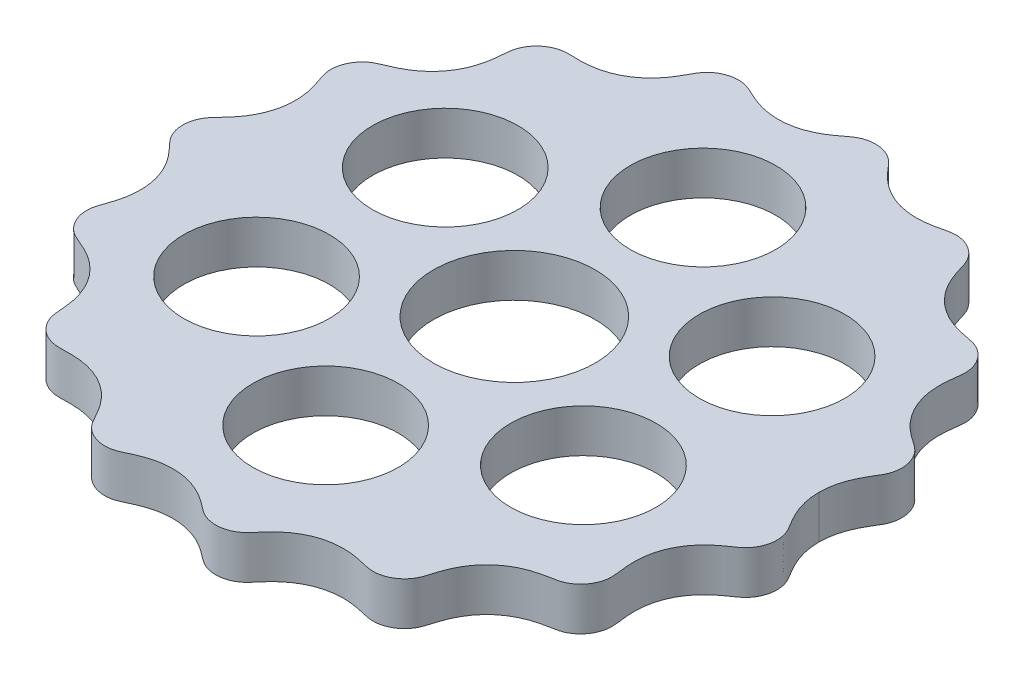
from build123d import *

# Parameters (mm, degrees)
SKETCH3_R           = 7.5
SKETCH3_R_2         = 6.75
BOSS_EXTRUDE1_DEPTH = 4


with BuildPart() as part:
    # Sketch3 → Boss-Extrude1 (new body)
    with BuildSketch(Plane(origin=(0, 0, 0), x_dir=(1, 0, 0), z_dir=(0, 1, 0))):
        with BuildLine():
            add(Edge.make_bspline(
                [(29.5, 0), (29.5, -0.029889461), (29.500501274, -0.089793684), (29.502757018, -0.199994007), (29.508769472, -0.345716178), (29.520033852, -0.516003517), (29.539534103, -0.719877503), (29.572667516, -0.972896461), (29.625712231, -1.26893095), (29.695940045, -1.57589139), (29.785086374, -1.891206047), (29.915742198, -2.279302585), (30.102039584, -2.734864508), (30.33495462, -3.200835277), (30.612620381, -3.677587615), (30.934069136, -4.194030434), (31.237194706, -4.727278247), (31.406093828, -5.378461077), (31.405725242, -6.117189546), (31.248335855, -6.800339452), (30.946423484, -7.409498164), (30.518681828, -7.912396516), (30.024477359, -8.2774), (29.550245165, -8.59502081), (29.055422495, -8.956812811), (28.55664588, -9.3787878), (28.071291676, -9.87632012), (27.618832314, -10.456259632), (27.233514149, -11.088357289), (26.923199049, -11.765079402), (26.693739537, -12.478190143), (26.549212855, -13.217291653), (26.492855654, -13.928538721), (26.50654453, -14.600813106), (26.567292453, -15.230937345), (26.651155977, -15.816199005), (26.716674088, -16.447312982), (26.62640489, -17.120976223), (26.35876322, -17.782346644), (25.918177073, -18.386904665), (25.381295585, -18.836179949), (24.795065003, -19.123538297), (24.20416515, -19.259668921), (23.651405896, -19.354435046), (23.149147383, -19.460869188), (22.701549759, -19.580730556), (22.221250647, -19.739640946), (21.713789444, -19.946736544), (21.145635648, -20.241997885), (20.533661927, -20.654546757), (19.969318303, -21.140042744), (19.462201082, -21.693788885), (19.020819266, -22.308674205), (18.671631778, -22.936971669), (18.402935315, -23.560968071), (18.196614764, -24.168544426), (18.031210068, -24.746637991), (17.836824154, -25.359563266), (17.481845811, -25.947378552), (16.962995745, -26.453160111), (16.302610967, -26.834433706), (15.605165751, -27.030879963), (14.918614525, -27.044392858), (14.290611017, -26.906273022), (13.707268128, -26.76047143), (13.077925596, -26.635361227), (12.403190484, -26.556062439), (11.684458703, -26.544316545), (10.931287881, -26.619125576), (10.198128539, -26.78142275), (9.495575967, -27.027420956), (8.914400316, -27.31099678), (8.446794063, -27.597140689), (8.075855138, -27.863479964), (7.791280828, -28.092219953), (7.481579097, -28.367944206), (7.154069437, -28.695657759), (6.810708629, -29.077401095), (6.45228992, -29.50872604), (6.038931991, -29.952392783), (5.496965868, -30.316405455), (4.839435928, -30.556720046), (4.095583639, -30.636000314), (3.38899707, -30.537099289), (2.760454369, -30.27844327), (2.246651709, -29.906145821), (1.781732794, -29.540887108), (1.266402425, -29.173215737), (0.691041037, -28.825223584), (0.046903188, -28.518406928), (-0.66543903, -28.274019755), (-1.397743593, -28.116182477), (-2.138955211, -28.046561644), (-2.879034252, -28.064209022), (-3.607493969, -28.166079072), (-4.281067062, -28.337644457), (-4.895863657, -28.558606199), (-5.456648804, -28.806245606), (-5.968747032, -29.058121981), (-6.532079721, -29.303629152), (-7.181276314, -29.422592585), (-7.882649472, -29.378078239), (-8.594278351, -29.15231418), (-9.198278317, -28.780347353), (-9.667919205, -28.297811687), (-9.987828208, -27.756370733), (-10.260491808, -27.237871371), (-10.576767616, -26.696230387), (-10.953650895, -26.146870654), (-11.408815704, -25.605953656), (-11.950184555, -25.092464451), (-12.548165998, -24.645439778), (-13.194493936, -24.272282169), (-13.88061938, -23.977927385), (-14.595998502, -23.765832809), (-15.292028768, -23.642107021), (-15.956229893, -23.590396394), (-16.583442648, -23.587314002), (-17.168808068, -23.610430078), (-17.79766419, -23.604101232), (-18.450372779, -23.438648125), (-19.074505483, -23.101552224), (-19.625837334, -22.598145566), (-20.015074466, -22.012995768), (-20.23664741, -21.391293307), (-20.305698303, -20.780679307), (-20.343616085, -20.211251037), (-20.409546628, -19.601777164), (-20.525586467, -18.958866797), (-20.713792994, -18.28975274), (-20.98980086, -17.607953023), (-21.344557209, -16.958202197), (-21.775456582, -16.351104338), (-22.2782997, -15.795828927), (-22.846116736, -15.301115548), (-23.433895979, -14.896684969), (-24.022947843, -14.572402127), (-24.599023965, -14.309950779), (-25.147809675, -14.089945054), (-25.727125692, -13.831132821), (-26.26540634, -13.416119), (-26.704339817, -12.853660239), (-27.007624154, -12.169804958), (-27.128243584, -11.480242215), (-27.084026477, -10.828826935), (-26.906402138, -10.249106449), (-26.7122212, -9.722867749), (-26.524712227, -9.148060531), (-26.36609006, -8.521461383), (-26.260469314, -7.840015999), (-26.22782757, -7.109204715), (-26.279232637, -6.372836761), (-26.417456605, -5.641378167), (-26.643471264, -4.925378903), (-26.916327948, -4.321772504), (-27.198539155, -3.829853606), (-27.494220956, -3.391733715), (-27.793312582, -3.00332682), (-28.153637798, -2.591986094), (-28.572215157, -2.159464513), (-28.90921809, -1.789990126), (-29.124632087, -1.45558278), (-29.252718115, -1.193085775), (-29.323765371, -1.017900193), (-29.382904352, -0.838786396), (-29.4301833, -0.65550882), (-29.461173363, -0.493251706), (-29.480345975, -0.355378471), (-29.491402713, -0.233802562), (-29.497298265, -0.132392574), (-29.499508775, -0.061726851), (-29.5, -0.020506856), (-29.5, 0)],
                knots=[0.063267729, 0.063267729, 0.063267729, 0.063267729, 0.063267729, 0.064441566, 0.065615404, 0.066789241, 0.067963079, 0.070310753, 0.072658428, 0.075454292, 0.078250156, 0.081046021, 0.083841885, 0.089433613, 0.095025341, 0.098832185, 0.102639028, 0.110252715, 0.115841232, 0.121429749, 0.127692743, 0.133955737, 0.138834056, 0.143712374, 0.148590693, 0.153469011, 0.15973469, 0.166000368, 0.172266046, 0.178531725, 0.184946169, 0.191360613, 0.197775057, 0.204189501, 0.209244271, 0.214299041, 0.219353812, 0.224408582, 0.230819531, 0.23723048, 0.243460713, 0.249690946, 0.254485642, 0.259280338, 0.264075034, 0.26886973, 0.271985532, 0.275101335, 0.28133294, 0.287564545, 0.293796151, 0.300242347, 0.306688543, 0.313134739, 0.319580935, 0.324722071, 0.329863208, 0.335004344, 0.34014548, 0.346588344, 0.353031207, 0.359474071, 0.365916935, 0.371058071, 0.376199207, 0.381340343, 0.386481479, 0.392927675, 0.399373872, 0.405820068, 0.412266264, 0.418497869, 0.424729474, 0.427845277, 0.430961079, 0.434076882, 0.437192685, 0.441987381, 0.446782076, 0.451576772, 0.456371468, 0.462601701, 0.468831935, 0.475242884, 0.481653832, 0.486708603, 0.491763373, 0.496818143, 0.501872914, 0.508287358, 0.514701802, 0.521116246, 0.52753069, 0.533796368, 0.540062047, 0.546327725, 0.552593403, 0.557471722, 0.56235004, 0.567228359, 0.572106677, 0.578369671, 0.584632665, 0.590985014, 0.597337363, 0.602345806, 0.607354249, 0.612362692, 0.617371135, 0.623727028, 0.630082921, 0.636438814, 0.642794707, 0.649150601, 0.655506494, 0.661862387, 0.66821828, 0.673226723, 0.678235166, 0.683243609, 0.688252052, 0.694604401, 0.70095675, 0.707219744, 0.713482738, 0.718361056, 0.723239375, 0.728117693, 0.732996012, 0.73926169, 0.745527368, 0.751793047, 0.758058725, 0.764473169, 0.770887613, 0.777302057, 0.783716501, 0.788771271, 0.793826042, 0.798880812, 0.803935582, 0.810346531, 0.81675748, 0.822987713, 0.829217947, 0.834012643, 0.838807338, 0.843602034, 0.84839673, 0.854628335, 0.860859941, 0.867091546, 0.873323151, 0.879769347, 0.886215543, 0.89266174, 0.895884838, 0.899107936, 0.904249072, 0.909390208, 0.914531344, 0.91967248, 0.921283196, 0.922893912, 0.924504628, 0.926115344, 0.92772606, 0.929336776, 0.930142134, 0.930947492, 0.93175285, 0.932558208, 0.932558208, 0.932558208, 0.932558208, 0.932558208], degree=4))
            add(Edge.make_bspline(
                [(29.5, 0), (29.5, 0.029889461), (29.500501274, 0.089793684), (29.502757018, 0.199994007), (29.508769472, 0.345716178), (29.520033852, 0.516003517), (29.539534103, 0.719877503), (29.572667516, 0.972896461), (29.625712231, 1.26893095), (29.695940045, 1.57589139), (29.785086374, 1.891206047), (29.915742198, 2.279302585), (30.102039584, 2.734864508), (30.33495462, 3.200835277), (30.612620381, 3.677587615), (30.934069136, 4.194030434), (31.237194706, 4.727278247), (31.406093828, 5.378461077), (31.405725242, 6.117189546), (31.248335855, 6.800339452), (30.946423484, 7.409498164), (30.518681828, 7.912396516), (30.024477359, 8.2774), (29.550245165, 8.59502081), (29.055422495, 8.956812811), (28.55664588, 9.3787878), (28.071291676, 9.87632012), (27.618832314, 10.456259632), (27.233514149, 11.088357289), (26.923199049, 11.765079402), (26.693739537, 12.478190143), (26.549212855, 13.217291653), (26.492855654, 13.928538721), (26.50654453, 14.600813106), (26.567292453, 15.230937345), (26.651155977, 15.816199005), (26.716674088, 16.447312982), (26.62640489, 17.120976223), (26.35876322, 17.782346644), (25.918177073, 18.386904665), (25.381295585, 18.836179949), (24.795065003, 19.123538297), (24.20416515, 19.259668921), (23.651405896, 19.354435046), (23.149147383, 19.460869188), (22.701549759, 19.580730556), (22.221250647, 19.739640946), (21.713789444, 19.946736544), (21.145635648, 20.241997885), (20.533661927, 20.654546757), (19.969318303, 21.140042744), (19.462201082, 21.693788885), (19.020819266, 22.308674205), (18.671631778, 22.936971669), (18.402935315, 23.560968071), (18.196614764, 24.168544426), (18.031210068, 24.746637991), (17.836824154, 25.359563266), (17.481845811, 25.947378552), (16.962995745, 26.453160111), (16.302610967, 26.834433706), (15.605165751, 27.030879963), (14.918614525, 27.044392858), (14.290611017, 26.906273022), (13.707268128, 26.76047143), (13.077925596, 26.635361227), (12.403190484, 26.556062439), (11.684458703, 26.544316545), (10.931287881, 26.619125576), (10.198128539, 26.78142275), (9.495575967, 27.027420956), (8.914400316, 27.31099678), (8.446794063, 27.597140689), (8.075855138, 27.863479964), (7.791280828, 28.092219953), (7.481579097, 28.367944206), (7.154069437, 28.695657759), (6.810708629, 29.077401095), (6.45228992, 29.50872604), (6.038931991, 29.952392783), (5.496965868, 30.316405455), (4.839435928, 30.556720046), (4.095583639, 30.636000314), (3.38899707, 30.537099289), (2.760454369, 30.27844327), (2.246651709, 29.906145821), (1.781732794, 29.540887108), (1.266402425, 29.173215737), (0.691041037, 28.825223584), (0.046903188, 28.518406928), (-0.66543903, 28.274019755), (-1.397743593, 28.116182477), (-2.138955211, 28.046561644), (-2.879034252, 28.064209022), (-3.607493969, 28.166079072), (-4.281067062, 28.337644457), (-4.895863657, 28.558606199), (-5.456648804, 28.806245606), (-5.968747032, 29.058121981), (-6.532079721, 29.303629152), (-7.181276314, 29.422592585), (-7.882649472, 29.378078239), (-8.594278351, 29.15231418), (-9.198278317, 28.780347353), (-9.667919205, 28.297811687), (-9.987828208, 27.756370733), (-10.260491808, 27.237871371), (-10.576767616, 26.696230387), (-10.953650895, 26.146870654), (-11.408815704, 25.605953656), (-11.950184555, 25.092464451), (-12.548165998, 24.645439778), (-13.194493936, 24.272282169), (-13.88061938, 23.977927385), (-14.595998502, 23.765832809), (-15.292028768, 23.642107021), (-15.956229893, 23.590396394), (-16.583442648, 23.587314002), (-17.168808068, 23.610430078), (-17.79766419, 23.604101232), (-18.450372779, 23.438648125), (-19.074505483, 23.101552224), (-19.625837334, 22.598145566), (-20.015074466, 22.012995768), (-20.23664741, 21.391293307), (-20.305698303, 20.780679307), (-20.343616085, 20.211251037), (-20.409546628, 19.601777164), (-20.525586467, 18.958866797), (-20.713792994, 18.28975274), (-20.98980086, 17.607953023), (-21.344557209, 16.958202197), (-21.775456582, 16.351104338), (-22.2782997, 15.795828927), (-22.846116736, 15.301115548), (-23.433895979, 14.896684969), (-24.022947843, 14.572402127), (-24.599023965, 14.309950779), (-25.147809675, 14.089945054), (-25.727125692, 13.831132821), (-26.26540634, 13.416119), (-26.704339817, 12.853660239), (-27.007624154, 12.169804958), (-27.128243584, 11.480242215), (-27.084026477, 10.828826935), (-26.906402138, 10.249106449), (-26.7122212, 9.722867749), (-26.524712227, 9.148060531), (-26.36609006, 8.521461383), (-26.260469314, 7.840015999), (-26.22782757, 7.109204715), (-26.279232637, 6.372836761), (-26.417456605, 5.641378167), (-26.643471264, 4.925378903), (-26.916327948, 4.321772504), (-27.198539155, 3.829853606), (-27.494220956, 3.391733715), (-27.793312582, 3.00332682), (-28.153637798, 2.591986094), (-28.572215157, 2.159464513), (-28.90921809, 1.789990126), (-29.124632087, 1.45558278), (-29.252718115, 1.193085775), (-29.323765371, 1.017900193), (-29.382904352, 0.838786396), (-29.4301833, 0.65550882), (-29.461173363, 0.493251706), (-29.480345975, 0.355378471), (-29.491402713, 0.233802562), (-29.497298265, 0.132392574), (-29.499508775, 0.061726851), (-29.5, 0.020506856), (-29.5, 0)],
                knots=[0.063267729, 0.063267729, 0.063267729, 0.063267729, 0.063267729, 0.064441566, 0.065615404, 0.066789241, 0.067963079, 0.070310753, 0.072658428, 0.075454292, 0.078250156, 0.081046021, 0.083841885, 0.089433613, 0.095025341, 0.098832185, 0.102639028, 0.110252715, 0.115841232, 0.121429749, 0.127692743, 0.133955737, 0.138834056, 0.143712374, 0.148590693, 0.153469011, 0.15973469, 0.166000368, 0.172266046, 0.178531725, 0.184946169, 0.191360613, 0.197775057, 0.204189501, 0.209244271, 0.214299041, 0.219353812, 0.224408582, 0.230819531, 0.23723048, 0.243460713, 0.249690946, 0.254485642, 0.259280338, 0.264075034, 0.26886973, 0.271985532, 0.275101335, 0.28133294, 0.287564545, 0.293796151, 0.300242347, 0.306688543, 0.313134739, 0.319580935, 0.324722071, 0.329863208, 0.335004344, 0.34014548, 0.346588344, 0.353031207, 0.359474071, 0.365916935, 0.371058071, 0.376199207, 0.381340343, 0.386481479, 0.392927675, 0.399373872, 0.405820068, 0.412266264, 0.418497869, 0.424729474, 0.427845277, 0.430961079, 0.434076882, 0.437192685, 0.441987381, 0.446782076, 0.451576772, 0.456371468, 0.462601701, 0.468831935, 0.475242884, 0.481653832, 0.486708603, 0.491763373, 0.496818143, 0.501872914, 0.508287358, 0.514701802, 0.521116246, 0.52753069, 0.533796368, 0.540062047, 0.546327725, 0.552593403, 0.557471722, 0.56235004, 0.567228359, 0.572106677, 0.578369671, 0.584632665, 0.590985014, 0.597337363, 0.602345806, 0.607354249, 0.612362692, 0.617371135, 0.623727028, 0.630082921, 0.636438814, 0.642794707, 0.649150601, 0.655506494, 0.661862387, 0.66821828, 0.673226723, 0.678235166, 0.683243609, 0.688252052, 0.694604401, 0.70095675, 0.707219744, 0.713482738, 0.718361056, 0.723239375, 0.728117693, 0.732996012, 0.73926169, 0.745527368, 0.751793047, 0.758058725, 0.764473169, 0.770887613, 0.777302057, 0.783716501, 0.788771271, 0.793826042, 0.798880812, 0.803935582, 0.810346531, 0.81675748, 0.822987713, 0.829217947, 0.834012643, 0.838807338, 0.843602034, 0.84839673, 0.854628335, 0.860859941, 0.867091546, 0.873323151, 0.879769347, 0.886215543, 0.89266174, 0.895884838, 0.899107936, 0.904249072, 0.909390208, 0.914531344, 0.91967248, 0.921283196, 0.922893912, 0.924504628, 0.926115344, 0.92772606, 0.929336776, 0.930142134, 0.930947492, 0.93175285, 0.932558208, 0.932558208, 0.932558208, 0.932558208, 0.932558208], degree=4))
        make_face()
        with Locations(Location((1.25, 0, 0), (0, 0, 270))):
            Circle(SKETCH3_R, mode=Mode.SUBTRACT)
        with Locations(Location((1.25, 17.5, 0), (0, 0, 270))):
            Circle(SKETCH3_R_2, mode=Mode.SUBTRACT)
        with Locations(Location((16.405444566, 8.75, 0), (0, 0, 270))):
            Circle(SKETCH3_R_2, mode=Mode.SUBTRACT)
        with Locations(Location((16.405444566, -8.75, 0), (0, 0, 270))):
            Circle(SKETCH3_R_2, mode=Mode.SUBTRACT)
        with Locations(Location((1.25, -17.5, 0), (0, 0, 270))):
            Circle(SKETCH3_R_2, mode=Mode.SUBTRACT)
        with Locations(Location((-13.905444566, -8.75, 0), (0, 0, 270))):
            Circle(SKETCH3_R_2, mode=Mode.SUBTRACT)
        with Locations(Location((-13.905444566, 8.75, 0), (0, 0, 270))):
            Circle(SKETCH3_R_2, mode=Mode.SUBTRACT)
    extrude(amount=BOSS_EXTRUDE1_DEPTH)


solid = part.part
